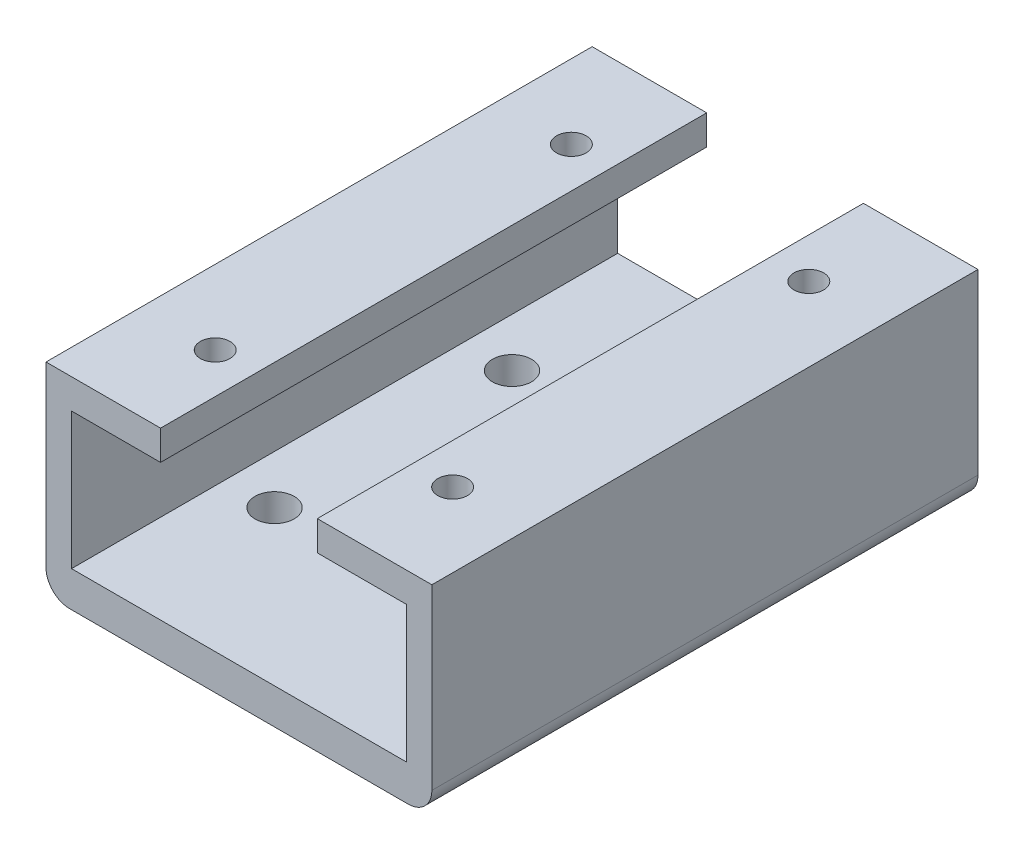
from build123d import *

# Parameters (mm, degrees)
SKETCH_1_W          = 32.5
SKETCH_1_H          = 46
EXTRUDE_1_DEPTH     = 17
SKETCH_2_W          = 13.2
SKETCH_2_H          = 2.5
CUT_EXTRUDE_2_DEPTH = 52.662970298
CUT_EXTRUDE_3_REACH = 34.895
SKETCH_4_R          = 1.65
SKETCH_5_R          = 1.25
CUT_EXTRUDE_4_DEPTH = 2
FILLET_1_R          = 2


with BuildPart() as part:
    # 草图1 → 凸台-拉伸1 (new body)
    with BuildSketch(Plane(origin=(0, 0, 0), x_dir=(1, 0, 0), z_dir=(0, 1, 0))):
        Rectangle(SKETCH_1_W, SKETCH_1_H)
    extrude(amount=EXTRUDE_1_DEPTH)

    # 草图2 → 切除-拉伸2 (cut, through all)
    with BuildSketch(Plane(origin=(0, 0, -23), x_dir=(-1, 0, 0), z_dir=(0, 0, -1))):
        with Locations((0, 15.75)):
            Rectangle(SKETCH_2_W, SKETCH_2_H)
        Polygon((6.6, 14.5), (-6.6, 14.5), (-14.1, 14.5), (-14.1, 3), (14.1, 3), (14.1, 14.5), align=None)
    extrude(amount=-CUT_EXTRUDE_2_DEPTH, mode=Mode.SUBTRACT)

    # 草图4 → 切除-拉伸3 (cut, up to next)
    with BuildSketch(Plane.XZ, mode=Mode.PRIVATE) as cut_extrude_3_sk1:
        with Locations(Location((-10, 10, 0), (0, 0, 270))):
            Circle(SKETCH_4_R)
    cut_extrude_3_tool1 = extrude(cut_extrude_3_sk1.sketch, amount=-CUT_EXTRUDE_3_REACH, mode=Mode.PRIVATE) & part.part
    # 草图4 → 切除-拉伸3 (cut, up to next)
    with BuildSketch(Plane.XZ, mode=Mode.PRIVATE) as cut_extrude_3_sk2:
        with Locations(Location((10, 10, 0), (0, 0, 270))):
            Circle(SKETCH_4_R)
    cut_extrude_3_tool2 = extrude(cut_extrude_3_sk2.sketch, amount=-CUT_EXTRUDE_3_REACH, mode=Mode.PRIVATE) & part.part
    # 草图4 → 切除-拉伸3 (cut, up to next)
    with BuildSketch(Plane.XZ, mode=Mode.PRIVATE) as cut_extrude_3_sk3:
        with Locations(Location((10, -10, 0), (0, 0, 270))):
            Circle(SKETCH_4_R)
    cut_extrude_3_tool3 = extrude(cut_extrude_3_sk3.sketch, amount=-CUT_EXTRUDE_3_REACH, mode=Mode.PRIVATE) & part.part
    # 草图4 → 切除-拉伸3 (cut, up to next)
    with BuildSketch(Plane.XZ, mode=Mode.PRIVATE) as cut_extrude_3_sk4:
        with Locations(Location((-10, -10, 0), (0, 0, 270))):
            Circle(SKETCH_4_R)
    cut_extrude_3_tool4 = extrude(cut_extrude_3_sk4.sketch, amount=-CUT_EXTRUDE_3_REACH, mode=Mode.PRIVATE) & part.part
    add(cut_extrude_3_tool1.solids().sort_by_distance((-10, 0, 10))[0], mode=Mode.SUBTRACT)
    add(cut_extrude_3_tool2.solids().sort_by_distance((10, 0, 10))[0], mode=Mode.SUBTRACT)
    add(cut_extrude_3_tool3.solids().sort_by_distance((10, 0, -10))[0], mode=Mode.SUBTRACT)
    add(cut_extrude_3_tool4.solids().sort_by_distance((-10, 0, -10))[0], mode=Mode.SUBTRACT)

    # 草图5 → 切除-拉伸4 (cut)
    with BuildSketch(Plane(origin=(0, 17, 0), x_dir=(1, 0, 0), z_dir=(0, 1, 0))):
        with Locations(Location((-10, 15, 0), (0, 0, 270))):
            Circle(SKETCH_5_R)
        with Locations(Location((10, 15, 0), (0, 0, 270))):
            Circle(SKETCH_5_R)
        with Locations(Location((10, -15, 0), (0, 0, 270))):
            Circle(SKETCH_5_R)
        with Locations(Location((-10, -15, 0), (0, 0, 270))):
            Circle(SKETCH_5_R)
    extrude(amount=-CUT_EXTRUDE_4_DEPTH, mode=Mode.SUBTRACT)

    # 圆角1
    fillet_1_edges = [part.edges().sort_by_distance(p)[0] for p in [
        (16.25, 0, 0),
        (-16.25, 0, 0),
    ]]
    fillet(fillet_1_edges, radius=FILLET_1_R)


solid = part.part
